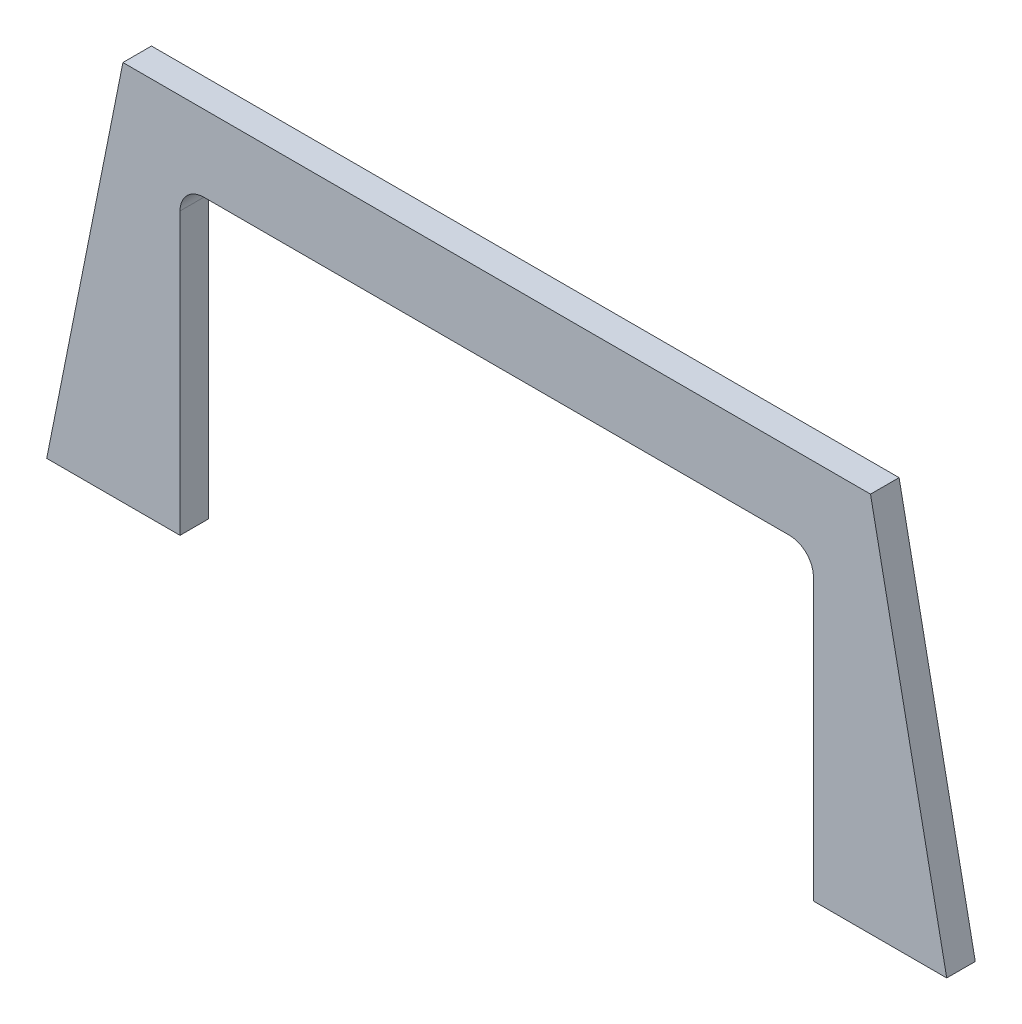
from build123d import *

# Parameters (mm, degrees)
RESSALTO_EXTRUS_O1_DEPTH = 6


with BuildPart() as part:
    # Esboço1 → Ressalto-extrusão1 (new body)
    with BuildSketch(Plane.XY):
        with BuildLine():
            Line((-66.5, -40), (-94.5, -40))
            Line((-94.5, -40), (-78.5, 40))
            Line((-78.5, 40), (78.5, 40))
            Line((78.5, 40), (94.5, -40))
            Line((94.5, -40), (66.5, -40))
            Line((66.5, -40), (66.5, 19))
            ThreePointArc((66.5, 19), (65.035533906, 22.535533906), (61.5, 24))
            Line((61.5, 24), (-61.5, 24))
            ThreePointArc((-61.5, 24), (-65.035533906, 22.535533906), (-66.5, 19))
            Line((-66.5, 19), (-66.5, -40))
        make_face()
    extrude(amount=RESSALTO_EXTRUS_O1_DEPTH)


solid = part.part
